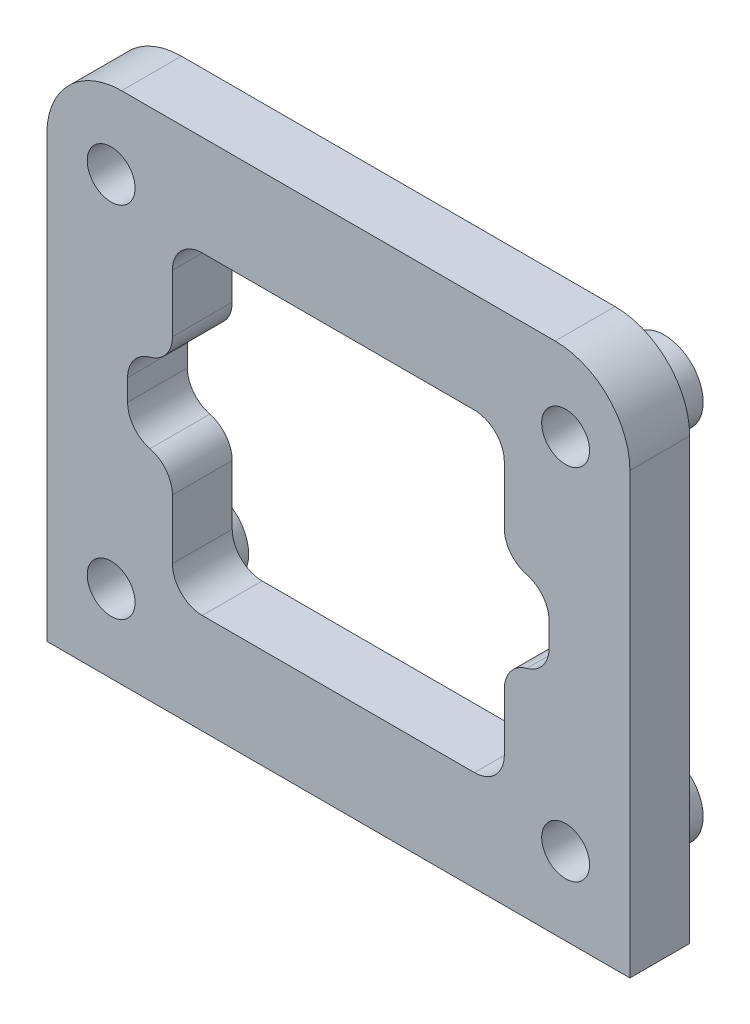
from build123d import *

# Parameters (mm, degrees)
SKETCH1_W           = 39
SKETCH1_H           = 34.4
SKETCH1_R           = 1.6
BOSS_EXTRUDE5_DEPTH = 4
FILLET1_R           = 5
BOSS_EXTRUDE6_START = -2.6
SKETCH4_R           = 2.6
SKETCH4_R_2         = 1.6
BOSS_EXTRUDE6_DEPTH = 2.6
FILLET4_R           = 2
FILLET5_R           = 2
FILLET6_R           = 2
FILLET8_R           = 2
FILLET9_R           = 2
FILLET10_R          = 2
FILLET11_R          = 2
FILLET12_R          = 2
FILLET13_R          = 2
FILLET14_R          = 2
FILLET15_R          = 2
FILLET16_R          = 2


with BuildPart() as part:
    # Sketch1 → Boss-Extrude5 (new body)
    with BuildSketch(Plane.XY):
        with Locations((0.200050248, -2.49430892)):
            Rectangle(SKETCH1_W, SKETCH1_H)
        with Locations((-14.999949752, 9.50569108)):
            Circle(SKETCH1_R, mode=Mode.SUBTRACT)
        with Locations((15.400050248, 9.50569108)):
            Circle(SKETCH1_R, mode=Mode.SUBTRACT)
        with Locations((-14.999949752, -14.49430892)):
            Circle(SKETCH1_R, mode=Mode.SUBTRACT)
        with Locations((15.400050248, -14.49430892)):
            Circle(SKETCH1_R, mode=Mode.SUBTRACT)
        Polygon((14.300050248, 0.15569108), (11.300050248, 0.15569108), (11.300050248, 8.00569108), (-10.899949752, 8.00569108), (-10.899949752, 0.15569108), (-13.899949752, 0.15569108), (-13.899949752, -5.14430892), (-10.899949752, -5.14430892), (-10.899949752, -12.99430892), (11.300050248, -12.99430892), (11.300050248, -5.14430892), (14.300050248, -5.14430892), align=None, mode=Mode.SUBTRACT)
    extrude(amount=BOSS_EXTRUDE5_DEPTH)

    # Fillet1
    fillet1_edges = [part.edges().sort_by_distance(p)[0] for p in [
        (-19.299949752, 14.70569108, 2),
        (19.700050248, 14.70569108, 2),
    ]]
    fillet(fillet1_edges, radius=FILLET1_R)

    # Sketch4 → Boss-Extrude6 (add)
    # profile 1 of 4: a face of its own
    with BuildSketch(Plane.XY.offset(BOSS_EXTRUDE6_START)):
        with Locations((15.400050248, 9.50569108)):
            Circle(SKETCH4_R)
        with Locations((15.400050248, 9.50569108)):
            Circle(SKETCH4_R_2, mode=Mode.SUBTRACT)
    # profile 2 of 4: a face of its own
    with BuildSketch(Plane.XY.offset(BOSS_EXTRUDE6_START)):
        with Locations((-14.999949752, 9.50569108)):
            Circle(SKETCH4_R)
        with Locations((-14.999949752, 9.50569108)):
            Circle(SKETCH4_R_2, mode=Mode.SUBTRACT)
    # profile 3 of 4: a face of its own
    with BuildSketch(Plane.XY.offset(BOSS_EXTRUDE6_START)):
        with Locations((15.400050248, -14.49430892)):
            Circle(SKETCH4_R)
        with Locations((15.400050248, -14.49430892)):
            Circle(SKETCH4_R_2, mode=Mode.SUBTRACT)
    # profile 4 of 4: a face of its own
    with BuildSketch(Plane.XY.offset(BOSS_EXTRUDE6_START)):
        with Locations((-14.999949752, -14.49430892)):
            Circle(SKETCH4_R)
        with Locations((-14.999949752, -14.49430892)):
            Circle(SKETCH4_R_2, mode=Mode.SUBTRACT)
    extrude(amount=BOSS_EXTRUDE6_DEPTH)

    # Fillet4
    fillet4_edges = [part.edges().sort_by_distance(p)[0] for p in [
        (-10.899949752, 8.00569108, 2),
    ]]
    fillet(fillet4_edges, radius=FILLET4_R)

    # Fillet5
    fillet5_edges = [part.edges().sort_by_distance(p)[0] for p in [
        (-10.899949752, 0.15569108, 2),
    ]]
    fillet(fillet5_edges, radius=FILLET5_R)

    # Fillet6
    fillet6_edges = [part.edges().sort_by_distance(p)[0] for p in [
        (-13.899949752, 0.15569108, 2),
    ]]
    fillet(fillet6_edges, radius=FILLET6_R)

    # Fillet8
    fillet8_edges = [part.edges().sort_by_distance(p)[0] for p in [
        (-13.899949752, -5.14430892, 2),
    ]]
    fillet(fillet8_edges, radius=FILLET8_R)

    # Fillet9
    fillet9_edges = [part.edges().sort_by_distance(p)[0] for p in [
        (-10.899949752, -5.14430892, 2),
    ]]
    fillet(fillet9_edges, radius=FILLET9_R)

    # Fillet10
    fillet10_edges = [part.edges().sort_by_distance(p)[0] for p in [
        (-10.899949752, -12.99430892, 2),
    ]]
    fillet(fillet10_edges, radius=FILLET10_R)

    # Fillet11
    fillet11_edges = [part.edges().sort_by_distance(p)[0] for p in [
        (11.300050248, -5.14430892, 2),
    ]]
    fillet(fillet11_edges, radius=FILLET11_R)

    # Fillet12
    fillet12_edges = [part.edges().sort_by_distance(p)[0] for p in [
        (11.300050248, 0.15569108, 2),
    ]]
    fillet(fillet12_edges, radius=FILLET12_R)

    # Fillet13
    fillet13_edges = [part.edges().sort_by_distance(p)[0] for p in [
        (11.300050248, -12.99430892, 2),
    ]]
    fillet(fillet13_edges, radius=FILLET13_R)

    # Fillet14
    fillet14_edges = [part.edges().sort_by_distance(p)[0] for p in [
        (14.300050248, 0.15569108, 2),
    ]]
    fillet(fillet14_edges, radius=FILLET14_R)

    # Fillet15
    fillet15_edges = [part.edges().sort_by_distance(p)[0] for p in [
        (11.300050248, 8.00569108, 2),
    ]]
    fillet(fillet15_edges, radius=FILLET15_R)

    # Fillet16
    fillet16_edges = [part.edges().sort_by_distance(p)[0] for p in [
        (14.300050248, -5.14430892, 2),
    ]]
    fillet(fillet16_edges, radius=FILLET16_R)


solid = part.part
